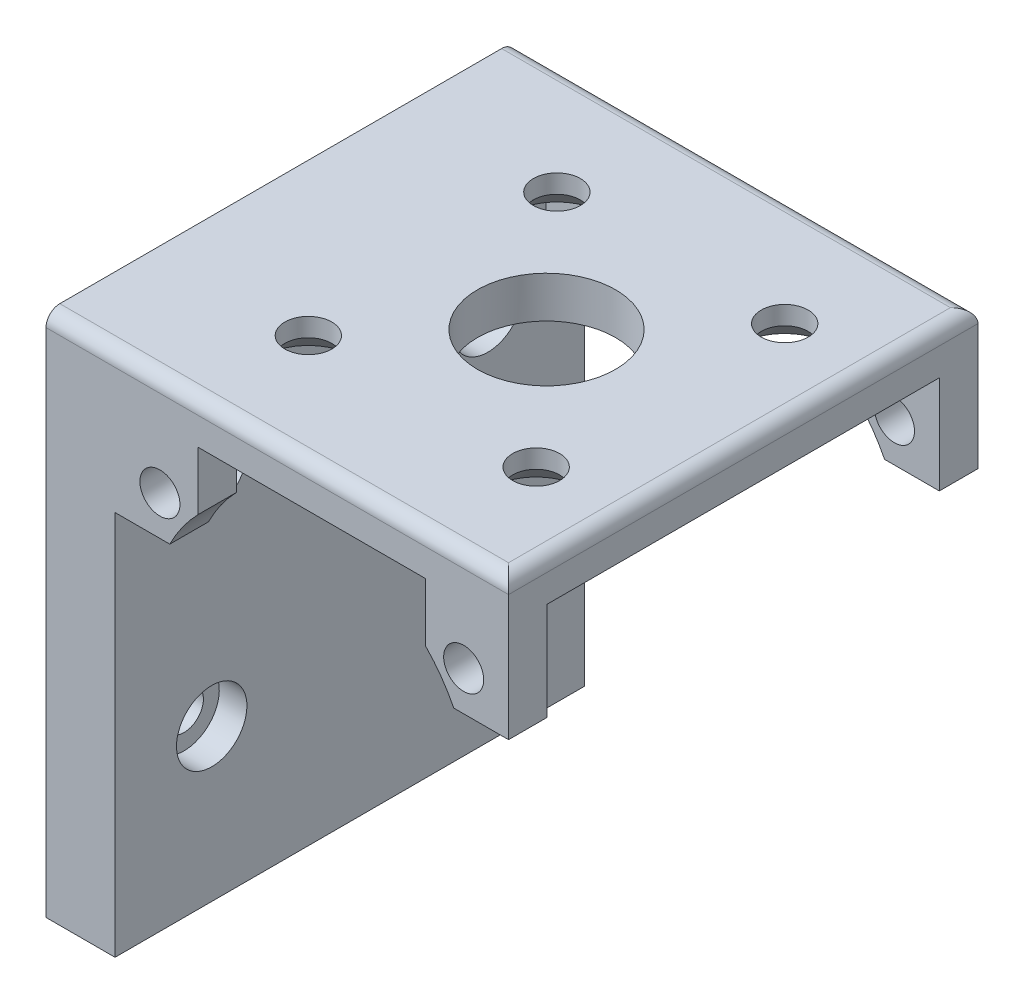
from build123d import *

# Parameters (mm, degrees)
BOSS_EXTRUDE7_DEPTH                          = 17
BOSS_EXTRUDE7_DEPTH_BACK                     = 17
SKETCH1_R                                    = 1.45
SKETCH34_W                                   = 28.4
SKETCH34_H                                   = 7.5
CUT_EXTRUDE11_DEPTH                          = 37.521397837
SKETCH35_R                                   = 5
CUT_EXTRUDE12_DEPTH                          = 25.542055741
CSK_FOR_M3_HEX_SOCKET_COUNTERSUNK_CA_2_COUNT = 2
CSK_FOR_M3_HEX_SOCKET_COUNTERSUNK_CA_2_PITCH = 16.5
CSK_FOR_M3_HEX_SOCKET_COUNTERSUNK_CA_3_COUNT = 2
CSK_FOR_M3_HEX_SOCKET_COUNTERSUNK_CA_3_PITCH = 18
CSK_FOR_M3_HEX_SOCKET_COUNTERSUNK_CA_4_COUNT = 2
CSK_FOR_M3_HEX_SOCKET_COUNTERSUNK_CA_4_PITCH = 24.418230894
FILLET5_R                                    = 1
SKETCH41_W                                   = 28.5
SKETCH41_H                                   = 0.4
CUT_EXTRUDE13_DEPTH                          = 40.895175147
BOSS_EXTRUDE8_START                          = 5
BOSS_EXTRUDE8_DEPTH                          = 5
SKETCH48_R                                   = 1.4
CUT_EXTRUDE14_DEPTH                          = 5
SKETCH49_R                                   = 2.55
CUT_EXTRUDE15_DEPTH                          = 2


with BuildPart() as part:
    # Sketch1 → Boss-Extrude7 (new, two sides: drawn at the far end of the back side and taken through both)
    with BuildSketch(Plane.XY.offset(-BOSS_EXTRUDE7_DEPTH_BACK)):
        with BuildLine():
            Line((-14.25, 15.25), (-14.25, 4.75))
            Line((-14.25, 4.75), (-10.473180033, 4.75))
            ThreePointArc((-10.473180033, 4.75), (-9.502581542, 6.476954843), (-8.25, 8.011710179))
            Line((-8.25, 8.011710179), (-8.25, 12.25))
            Line((-8.25, 12.25), (8.25, 12.25))
            Line((8.25, 12.25), (8.25, 8.011710179))
            ThreePointArc((8.25, 8.011710179), (9.502581542, 6.476954843), (10.473180033, 4.75))
            Line((10.473180033, 4.75), (14.25, 4.75))
            Line((14.25, 4.75), (14.25, 15.25))
            Line((14.25, 15.25), (-14.25, 15.25))
        make_face()
        with Locations((11, 8)):
            Circle(SKETCH1_R, mode=Mode.SUBTRACT)
        with Locations((-11, 8)):
            Circle(SKETCH1_R, mode=Mode.SUBTRACT)
    extrude(amount=BOSS_EXTRUDE7_DEPTH + BOSS_EXTRUDE7_DEPTH_BACK)

    # Sketch34 → Cut-Extrude11 (cut, through all)
    with BuildSketch(Plane.ZY.offset(14.25)):
        with Locations((0, 8.5)):
            Rectangle(SKETCH34_W, SKETCH34_H)
    extrude(amount=-CUT_EXTRUDE11_DEPTH, mode=Mode.SUBTRACT)

    # Sketch35 → Cut-Extrude12 (cut, through all)
    with BuildSketch(Plane(origin=(0, 15.25, 0), x_dir=(1, 0, 0), z_dir=(0, 1, 0))):
        Circle(SKETCH35_R)
    extrude(amount=-CUT_EXTRUDE12_DEPTH, mode=Mode.SUBTRACT)

    # Sketch40 → CSK for M3 Hex Socket Countersunk Cap Screw3 (revolve, cut)
    with BuildSketch(Plane(origin=(-8.25, 12.25, 9), x_dir=(0, 0, -1), z_dir=(1, 0, 0))):
        Polygon((0, 0), (0, 3), (1.7, 3), (1.7, 1.66), (3.36, 0), align=None)
    csk_for_m3_hex_socket_countersunk_cap_sc = revolve(axis=Axis((-8.25, 5.9, 9), (0, 1, 0)), mode=Mode.SUBTRACT)

    # CSK for M3 Hex Socket Countersunk Ca 2: CSK for M3 Hex Socket Countersunk Cap Screw3 ×2
    with Locations(*[(i * CSK_FOR_M3_HEX_SOCKET_COUNTERSUNK_CA_2_PITCH, 0, 0) for i in range(1, CSK_FOR_M3_HEX_SOCKET_COUNTERSUNK_CA_2_COUNT)]):
        add(csk_for_m3_hex_socket_countersunk_cap_sc, mode=Mode.SUBTRACT)

    # CSK for M3 Hex Socket Countersunk Ca 3: CSK for M3 Hex Socket Countersunk Cap Screw3 ×2
    with Locations(*[(0, 0, -i * CSK_FOR_M3_HEX_SOCKET_COUNTERSUNK_CA_3_PITCH) for i in range(1, CSK_FOR_M3_HEX_SOCKET_COUNTERSUNK_CA_3_COUNT)]):
        add(csk_for_m3_hex_socket_countersunk_cap_sc, mode=Mode.SUBTRACT)

    # CSK for M3 Hex Socket Countersunk Ca 4: CSK for M3 Hex Socket Countersunk Cap Screw3 ×2
    with Locations(*[Vector(0.6757246285173466, 0, -0.7371541402007413) * (i * CSK_FOR_M3_HEX_SOCKET_COUNTERSUNK_CA_4_PITCH) for i in range(1, CSK_FOR_M3_HEX_SOCKET_COUNTERSUNK_CA_4_COUNT)]):
        add(csk_for_m3_hex_socket_countersunk_cap_sc, mode=Mode.SUBTRACT)

    # Fillet5
    fillet5_edges = [part.edges().sort_by_distance(p)[0] for p in [
        (14.25, 15.25, 0),
        (0, 15.25, -17),
        (0, 15.25, 17),
    ]]
    fillet(fillet5_edges, radius=FILLET5_R)

    # Sketch41 → Cut-Extrude13 (cut, through all)
    with BuildSketch(Plane.XY.offset(17)):
        with Locations((0, 4.95)):
            Rectangle(SKETCH41_W, SKETCH41_H)
    extrude(amount=-CUT_EXTRUDE13_DEPTH, mode=Mode.SUBTRACT)

    # Sketch46 → Boss-Extrude8 (add)
    with BuildSketch(Plane.ZY.offset(14.25).offset(BOSS_EXTRUDE8_START)):
        with BuildLine():
            ThreePointArc((17, 14.25), (16.707106781, 14.957106781), (16, 15.25))
            Line((16, 15.25), (-16, 15.25))
            ThreePointArc((-16, 15.25), (-16.707106781, 14.957106781), (-17, 14.25))
            Line((-17, 14.25), (-17, -22.75))
            Line((-17, -22.75), (17, -22.75))
            Line((17, -22.75), (17, 14.25))
        make_face()
    extrude(amount=-BOSS_EXTRUDE8_DEPTH)

    # Sketch48 → Cut-Extrude14 (cut)
    with BuildSketch(Plane.ZY.offset(19.25)):
        with Locations((-10, -11.75)):
            Circle(SKETCH48_R)
        with Locations((10, -11.75)):
            Circle(SKETCH48_R)
        with Locations((10, 4.25)):
            Circle(SKETCH48_R)
        with Locations((-10, 4.25)):
            Circle(SKETCH48_R)
    extrude(amount=-CUT_EXTRUDE14_DEPTH, mode=Mode.SUBTRACT)

    # Sketch49 → Cut-Extrude15 (cut)
    with BuildSketch(Plane(origin=(-14.25, 0, 0), x_dir=(0, 0, -1), z_dir=(1, 0, 0))):
        with Locations((-10, -11.75)):
            Circle(SKETCH49_R)
        with Locations((10, -11.75)):
            Circle(SKETCH49_R)
        with Locations((10, 4.25)):
            Circle(SKETCH49_R)
        with Locations((-10, 4.25)):
            Circle(SKETCH49_R)
    extrude(amount=-CUT_EXTRUDE15_DEPTH, mode=Mode.SUBTRACT)


solid = part.part
